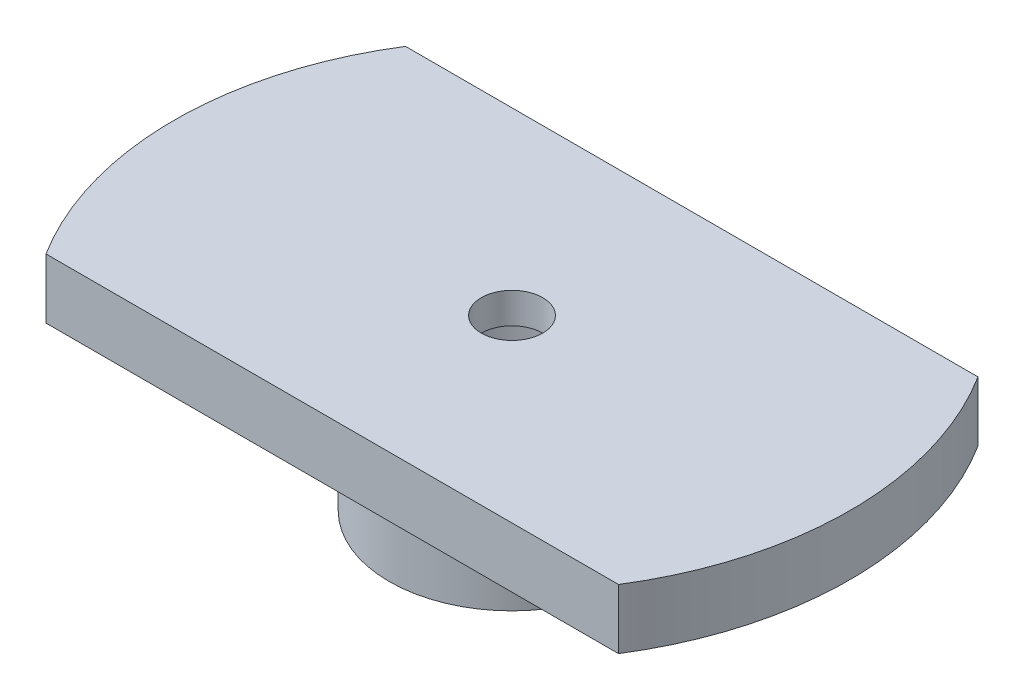
from build123d import *

# Parameters (mm, degrees)
BOSS_EXTRUDE1_DEPTH     = 1.95
SKETCH2_R               = 4
BOSS_EXTRUDE2_DEPTH     = 3.55
SKETCH3_R               = 2.86
CUT_EXTRUDE1_DEPTH      = 4.5
SKETCH4_R               = 1
CUT_EXTRUDE2_DEPTH      = 1
CUT_EXTRUDE3_DEPTH      = 25.219723368
CUT_EXTRUDE3_DEPTH_BACK = 25.219723368
SKETCH5_OUTSIDE_W       = 57.198
SKETCH5_OUTSIDE_H       = 23.198
SKETCH5_OUTSIDE_R       = 11


with BuildPart() as part:
    # Sketch1 → Boss-Extrude1 (new body)
    with BuildSketch(Plane(origin=(0, 0, 0), x_dir=(1, 0, 0), z_dir=(0, 1, 0))):
        with BuildLine():
            Line((17, 5.85), (-17, 5.85))
            ThreePointArc((-17, 5.85), (-21.13657467, 4.13657467), (-22.85, 0))
            ThreePointArc((-22.85, 0), (-21.13657467, -4.13657467), (-17, -5.85))
            Line((-17, -5.85), (17, -5.85))
            ThreePointArc((17, -5.85), (21.13657467, -4.13657467), (22.85, 0))
            ThreePointArc((22.85, 0), (21.13657467, 4.13657467), (17, 5.85))
        make_face()
    extrude(amount=-BOSS_EXTRUDE1_DEPTH)

    # Sketch2 → Boss-Extrude2 (add)
    with BuildSketch(Plane.XZ.offset(1.95)):
        with Locations(Location((0, 0, 0), (0, 0, 90))):
            Circle(SKETCH2_R)
    extrude(amount=BOSS_EXTRUDE2_DEPTH)

    # Sketch3 → Cut-Extrude1 (cut)
    with BuildSketch(Plane.XZ.offset(5.5)):
        with Locations(Location((0, 0, 0), (0, 0, 270))):
            Circle(SKETCH3_R)
    extrude(amount=-CUT_EXTRUDE1_DEPTH, mode=Mode.SUBTRACT)

    # Sketch4 → Cut-Extrude2 (cut)
    with BuildSketch(Plane.XZ.offset(1)):
        with Locations(Location((0, 0, 0), (0, 0, 270))):
            Circle(SKETCH4_R)
    extrude(amount=-CUT_EXTRUDE2_DEPTH, mode=Mode.SUBTRACT)

    # Sketch5 outside → Cut-Extrude3 (cut, two sides: drawn at the far end of the back side and taken through both)
    with BuildSketch(Plane(origin=(0, 0, 0), x_dir=(1, 0, 0), z_dir=(0, 1, 0)).offset(-CUT_EXTRUDE3_DEPTH_BACK)):
        Rectangle(SKETCH5_OUTSIDE_W, SKETCH5_OUTSIDE_H)
        Circle(SKETCH5_OUTSIDE_R, mode=Mode.SUBTRACT)
    extrude(amount=CUT_EXTRUDE3_DEPTH + CUT_EXTRUDE3_DEPTH_BACK, mode=Mode.SUBTRACT)


solid = part.part
